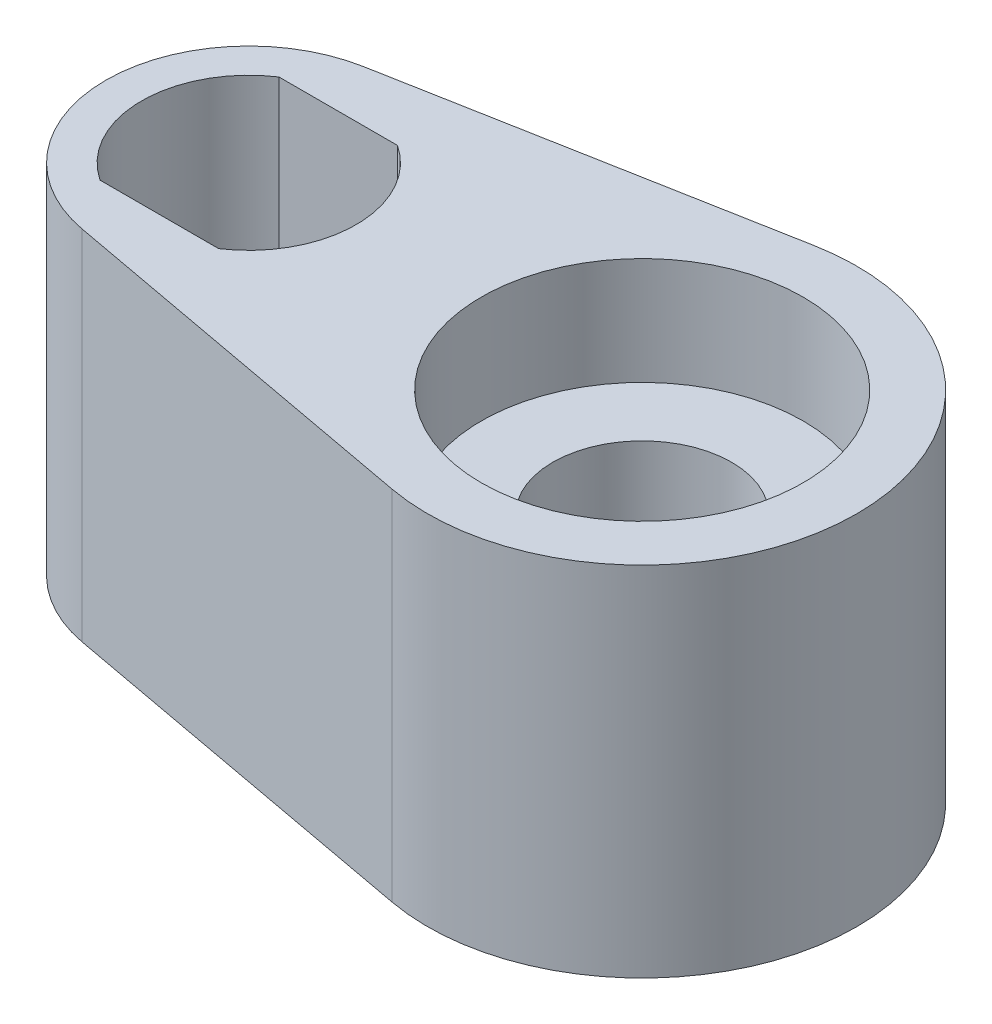
from build123d import *

# Parameters (mm, degrees)
SKETCH_1_R          = 1.5
SKETCH_1_R_2        = 1.1
EXTRUDE_1_DEPTH     = 6.5
SKETCH_2_R          = 4
SKETCH_2_R_2        = 1.1
EXTRUDE_2_DEPTH     = 1
EXTRUDE_3_DEPTH     = 9
SKETCH_4_R          = 2.5
EXTRUDE_4_DEPTH     = 10
SKETCH_5_R          = 4.5
CUT_EXTRUDE_1_DEPTH = 3
SKETCH_6_R          = 1.5
CUT_EXTRUDE_3_DEPTH = 6.5


with BuildPart() as part:
    # Эскиз1 → Бобышка-Вытянуть1 (new body)
    with BuildSketch(Plane(origin=(0, 0, 0), x_dir=(1, 0, 0), z_dir=(0, 1, 0))):
        with Locations(Location((0, 0, 0), (0, 0, 90))):
            Circle(SKETCH_1_R)
        with Locations(Location((0, 0, 0), (0, 0, 90))):
            Circle(SKETCH_1_R_2, mode=Mode.SUBTRACT)
    extrude(amount=EXTRUDE_1_DEPTH)

    # Эскиз2 → Бобышка-Вытянуть2 (add)
    with BuildSketch(Plane(origin=(0, 6.5, 0), x_dir=(1, 0, 0), z_dir=(0, 1, 0))):
        with Locations(Location((0, 0, 0), (0, 0, 270))):
            Circle(SKETCH_2_R)
        with Locations(Location((0, 0, 0), (0, 0, 90))):
            Circle(SKETCH_2_R_2, mode=Mode.SUBTRACT)
    extrude(amount=EXTRUDE_2_DEPTH)

    # Эскиз3 → Бобышка-Вытянуть3 (add)
    with BuildSketch(Plane(origin=(0, 7.5, 0), x_dir=(1, 0, 0), z_dir=(0, 1, 0))):
        with BuildLine():
            ThreePointArc((-3, 0), (-2.643382037, 1.418637165), (-1.658312395, 2.5))
            ThreePointArc((-1.658312395, 2.5), (0, 3), (1.658312395, 2.5))
            ThreePointArc((1.658312395, 2.5), (2.643382037, 1.418637165), (3, 0))
            Line((3, 0), (4, 0))
            ThreePointArc((4, 0), (0, 4), (-4, 0))
            Line((-4, 0), (-3, 0))
        make_face()
        with BuildLine():
            ThreePointArc((-1.658312395, -2.5), (-2.643382037, -1.418637165), (-3, 0))
            Line((-3, 0), (-4, 0))
            ThreePointArc((-4, 0), (0, -4), (4, 0))
            Line((4, 0), (3, 0))
            ThreePointArc((3, 0), (2.643382037, -1.418637165), (1.658312395, -2.5))
            ThreePointArc((1.658312395, -2.5), (0, -3), (-1.658312395, -2.5))
        make_face()
        with BuildLine():
            ThreePointArc((1.658312395, 2.5), (0, 3), (-1.658312395, 2.5))
            Line((-1.658312395, 2.5), (1.658312395, 2.5))
        make_face()
        with BuildLine():
            Line((1.658312395, -2.5), (-1.658312395, -2.5))
            ThreePointArc((-1.658312395, -2.5), (0, -3), (1.658312395, -2.5))
        make_face()
    extrude(amount=EXTRUDE_3_DEPTH)

    # Эскиз4 → Бобышка-Вытянуть4 (add)
    with BuildSketch(Plane.XZ.offset(-6.5)):
        with BuildLine():
            ThreePointArc((-0.727272727, 3.933328664), (4, 0), (-0.727272727, -3.933328664))
            Line((-0.727272727, -3.933328664), (9.909090909, -5.899992996))
            ThreePointArc((9.909090909, -5.899992996), (17, 0), (9.909090909, 5.899992996))
            Line((9.909090909, 5.899992996), (-0.727272727, 3.933328664))
        make_face()
        with Locations(Location((11, 0, 0), (0, 0, 270))):
            Circle(SKETCH_4_R, mode=Mode.SUBTRACT)
    extrude(amount=-EXTRUDE_4_DEPTH)

    # Эскиз5 → Вырез-Вытянуть1 (cut)
    with BuildSketch(Plane(origin=(0, 16.5, 0), x_dir=(1, 0, 0), z_dir=(0, 1, 0))):
        with Locations(Location((11, 0, 0), (0, 0, 270))):
            Circle(SKETCH_5_R)
    extrude(amount=-CUT_EXTRUDE_1_DEPTH, mode=Mode.SUBTRACT)

    # Эскиз6 → Вырез-Вытянуть3 (cut)
    with BuildSketch(Plane.XZ):
        Circle(SKETCH_6_R)
    extrude(amount=-CUT_EXTRUDE_3_DEPTH, mode=Mode.SUBTRACT)


solid = part.part
